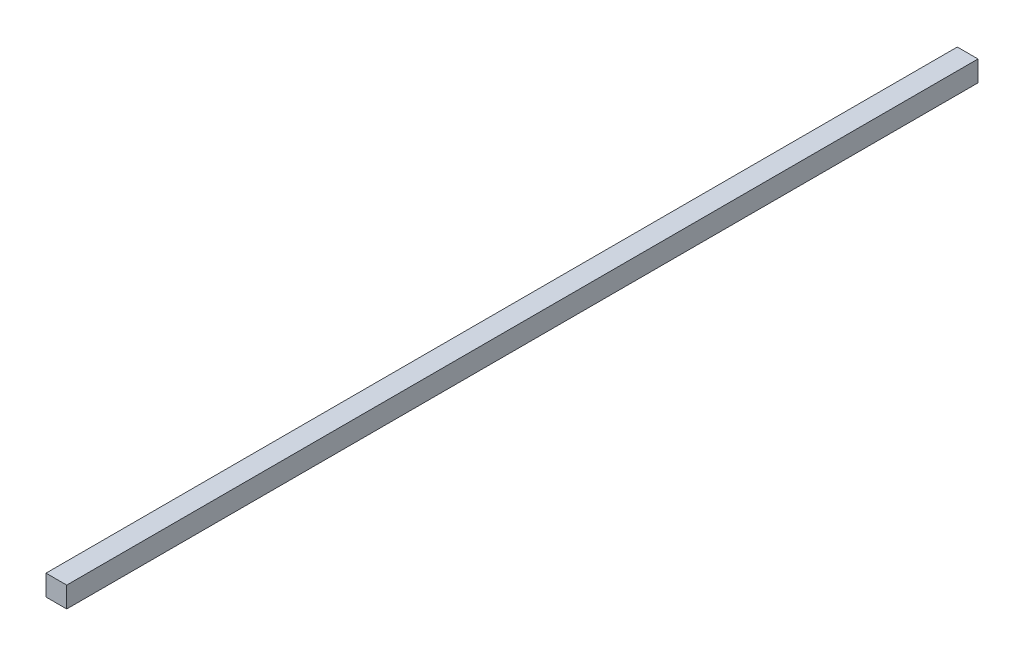
from build123d import *

# Parameters (mm, degrees)
SKETCH1_W           = 10
SKETCH1_H           = 10
BOSS_EXTRUDE1_DEPTH = 440


with BuildPart() as part:
    # Sketch1 → Boss-Extrude1 (new body)
    with BuildSketch(Plane.XY):
        Rectangle(SKETCH1_W, SKETCH1_H)
    extrude(amount=BOSS_EXTRUDE1_DEPTH)


solid = part.part
